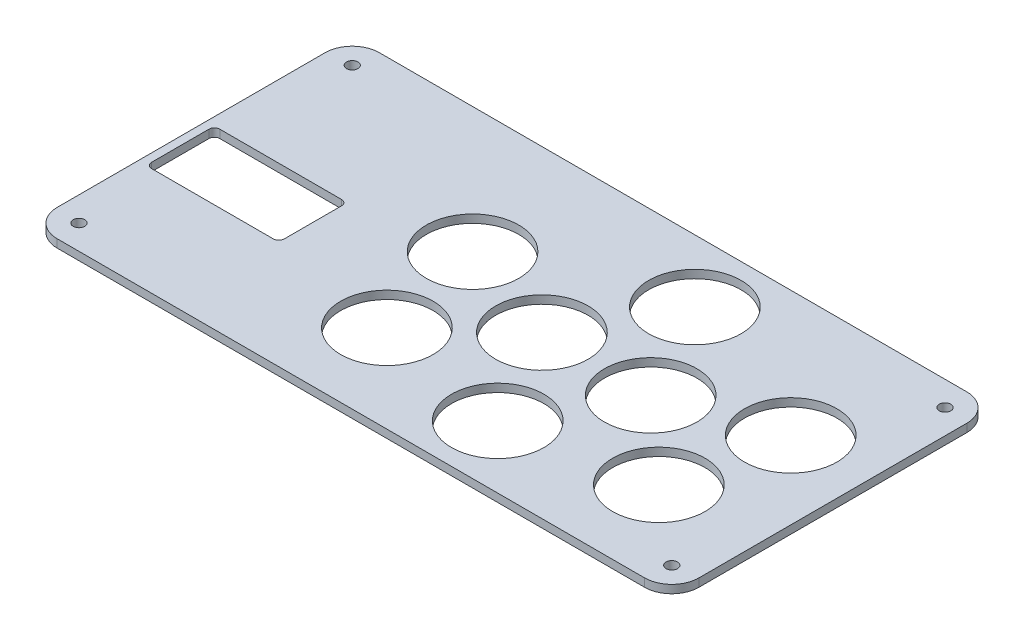
from build123d import *

# Parameters (mm, degrees)
SKETCH1_W           = 236
SKETCH1_H           = 118.5
SKETCH1_W_2         = 48.8
SKETCH1_H_2         = 25.1
SKETCH1_R           = 17
SKETCH1_R_2         = 2.125
BOSS_EXTRUDE1_DEPTH = 3
FILLET1_R           = 10
FILLET2_R           = 2


with BuildPart() as part:
    # Sketch1 → Boss-Extrude1 (new body)
    with BuildSketch(Plane(origin=(0, 0, 0), x_dir=(1, 0, 0), z_dir=(0, 1, 0))):
        with Locations((64.335496373, 41.57608502)):
            Rectangle(SKETCH1_W, SKETCH1_H)
        with Locations((-26.264503627, 34.57608502)):
            Rectangle(SKETCH1_W_2, SKETCH1_H_2, mode=Mode.SUBTRACT)
        with Locations(Location((75.335496373, 41.57608502, 0), (0, 0, 270))):
            Circle(SKETCH1_R, mode=Mode.SUBTRACT)
        with Locations(Location((115.335496373, 41.57608502, 0), (0, 0, 270))):
            Circle(SKETCH1_R, mode=Mode.SUBTRACT)
        with Locations(Location((153.835496373, 54.57608502, 0), (0, 0, 270))):
            Circle(SKETCH1_R, mode=Mode.SUBTRACT)
        with Locations(Location((95.335496373, 77.82608502, 0), (0, 0, 270))):
            Circle(SKETCH1_R, mode=Mode.SUBTRACT)
        with Locations(Location((173.335496373, 91.82608502, 0), (0, 0, 270))):
            Circle(SKETCH1_R_2, mode=Mode.SUBTRACT)
        with Locations(Location((-44.664503627, -8.67391498, 0), (0, 0, 270))):
            Circle(SKETCH1_R_2, mode=Mode.SUBTRACT)
        with Locations(Location((45.335496373, 14.57608502, 0), (0, 0, 270))):
            Circle(SKETCH1_R, mode=Mode.SUBTRACT)
        with Locations(Location((95.335496373, 5.32608502, 0), (0, 0, 270))):
            Circle(SKETCH1_R, mode=Mode.SUBTRACT)
        with Locations(Location((173.335496373, -8.67391498, 0), (0, 0, 270))):
            Circle(SKETCH1_R_2, mode=Mode.SUBTRACT)
        with Locations(Location((145.335496373, 14.57608502, 0), (0, 0, 270))):
            Circle(SKETCH1_R, mode=Mode.SUBTRACT)
        with Locations(Location((36.835496373, 54.57608502, 0), (0, 0, 270))):
            Circle(SKETCH1_R, mode=Mode.SUBTRACT)
        with Locations(Location((-44.664503627, 91.82608502, 0), (0, 0, 270))):
            Circle(SKETCH1_R_2, mode=Mode.SUBTRACT)
    extrude(amount=BOSS_EXTRUDE1_DEPTH)

    # Fillet1
    fillet1_edges = [part.edges().sort_by_distance(p)[0] for p in [
        (182.335496373, 1.5, -100.82608502),
        (182.335496373, 1.5, 17.67391498),
        (-53.664503627, 1.5, 17.67391498),
        (-53.664503627, 1.5, -100.82608502),
    ]]
    fillet(fillet1_edges, radius=FILLET1_R)

    # Fillet2
    fillet2_edges = [part.edges().sort_by_distance(p)[0] for p in [
        (-50.664503627, 1.5, -22.02608502),
        (-1.864503627, 1.5, -22.02608502),
        (-1.864503627, 1.5, -47.12608502),
        (-50.664503627, 1.5, -47.12608502),
    ]]
    fillet(fillet2_edges, radius=FILLET2_R)


solid = part.part
